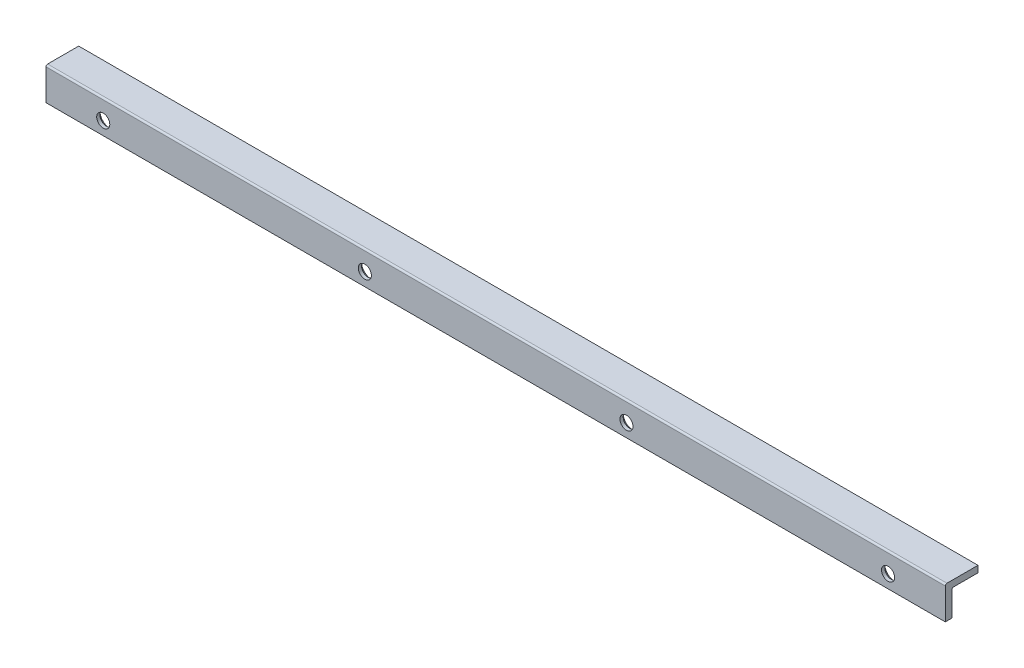
from build123d import *

# Parameters (mm, degrees)
BOSS_EXTRUDE1_DEPTH      = 137.5
BOSS_EXTRUDE1_DEPTH_BACK = 137.5
SKETCH2_R                = 2
CUT_EXTRUDE1_DEPTH       = 139.225359468
CHAMFER1_SIZE            = 1


with BuildPart() as part:
    # Sketch1 → Boss-Extrude1 (new, two sides: drawn at the far end of the back side and taken through both)
    with BuildSketch(Plane(origin=(0, 0, 0), x_dir=(0, 0, -1), z_dir=(1, 0, 0)).offset(-BOSS_EXTRUDE1_DEPTH_BACK)):
        with BuildLine():
            Line((0, -10), (0, -0.5))
            ThreePointArc((0, -0.5), (0.146446609, -0.146446609), (0.5, 0))
            Line((0.5, 0), (10, 0))
            Line((10, 0), (10, -2))
            Line((10, -2), (2.5, -2))
            ThreePointArc((2.5, -2), (2.146446609, -2.146446609), (2, -2.5))
            Line((2, -2.5), (2, -10))
            Line((2, -10), (0, -10))
        make_face()
    extrude(amount=BOSS_EXTRUDE1_DEPTH + BOSS_EXTRUDE1_DEPTH_BACK)

    # Sketch2 → Cut-Extrude1 (cut, through all)
    with BuildSketch(Plane.XY):
        with Locations((-120, -6)):
            Circle(SKETCH2_R)
        with Locations((-40, -6)):
            Circle(SKETCH2_R)
        with Locations((40, -6)):
            Circle(SKETCH2_R)
        with Locations((120, -6)):
            Circle(SKETCH2_R)
    extrude(amount=-CUT_EXTRUDE1_DEPTH, mode=Mode.SUBTRACT)

    # Chamfer1
    chamfer1_edges = [part.edges().sort_by_distance(p)[0] for p in [
        (-122, -6, -2),
        (-42, -6, -2),
        (38, -6, -2),
        (118, -6, -2),
    ]]
    chamfer(chamfer1_edges, length=CHAMFER1_SIZE)


solid = part.part
